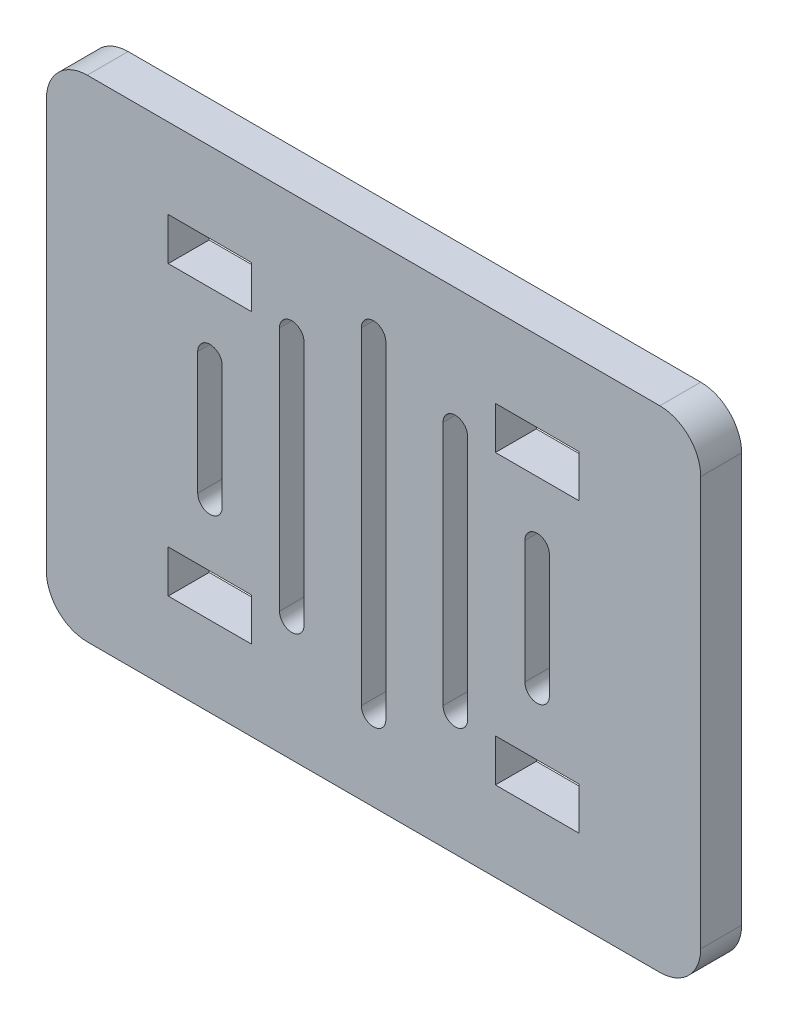
from build123d import *

# Parameters (mm, degrees)
SKETCH1_W           = 5.2
SKETCH1_H           = 10.2
BOSS_EXTRUDE1_DEPTH = 2.5
FILLET1_R           = 5


with BuildPart() as part:
    # Sketch1 → Boss-Extrude1 (new, symmetric)
    with BuildSketch(Plane(origin=(0, 0, 0), x_dir=(0, 1, 0), z_dir=(0, 0, 1))):
        Polygon((30, 0), (30, -20), (-30, -20), (-30, 0), (-30, 40), (-30, 60), (30, 60), (30, 40), align=None)
        with Locations((17.6, 0)):
            Rectangle(SKETCH1_W, SKETCH1_H, mode=Mode.SUBTRACT)
        with Locations((17.6, 40)):
            Rectangle(SKETCH1_W, SKETCH1_H, mode=Mode.SUBTRACT)
        with Locations((-17.6, 0)):
            Rectangle(SKETCH1_W, SKETCH1_H, mode=Mode.SUBTRACT)
        with Locations((-17.6, 40)):
            Rectangle(SKETCH1_W, SKETCH1_H, mode=Mode.SUBTRACT)
        with BuildLine():
            Line((7.5, 41.5), (-7.5, 41.5))
            ThreePointArc((-7.5, 41.5), (-9, 40), (-7.5, 38.5))
            Line((-7.5, 38.5), (7.5, 38.5))
            ThreePointArc((7.5, 38.5), (9, 40), (7.5, 41.5))
        make_face(mode=Mode.SUBTRACT)
        with BuildLine():
            Line((15, 31.5), (-15, 31.5))
            ThreePointArc((-15, 31.5), (-16.5, 30), (-15, 28.5))
            Line((-15, 28.5), (15, 28.5))
            ThreePointArc((15, 28.5), (16.5, 30), (15, 31.5))
        make_face(mode=Mode.SUBTRACT)
        with BuildLine():
            Line((20, 21.5), (-20, 21.5))
            ThreePointArc((-20, 21.5), (-21.5, 20), (-20, 18.5))
            Line((-20, 18.5), (20, 18.5))
            ThreePointArc((20, 18.5), (21.5, 20), (20, 21.5))
        make_face(mode=Mode.SUBTRACT)
        with BuildLine():
            Line((15, 11.5), (-15, 11.5))
            ThreePointArc((-15, 11.5), (-16.5, 10), (-15, 8.5))
            Line((-15, 8.5), (15, 8.5))
            ThreePointArc((15, 8.5), (16.5, 10), (15, 11.5))
        make_face(mode=Mode.SUBTRACT)
        with BuildLine():
            Line((7.5, 1.5), (-7.5, 1.5))
            ThreePointArc((-7.5, 1.5), (-9, 0), (-7.5, -1.5))
            Line((-7.5, -1.5), (7.5, -1.5))
            ThreePointArc((7.5, -1.5), (9, 0), (7.5, 1.5))
        make_face(mode=Mode.SUBTRACT)
    extrude(amount=BOSS_EXTRUDE1_DEPTH, both=True)

    # Fillet1
    fillet1_edges = [part.edges().sort_by_distance(p)[0] for p in [
        (-60, -30, 0),
        (-60, 30, 0),
        (20, 30, 0),
        (20, -30, 0),
    ]]
    fillet(fillet1_edges, radius=FILLET1_R)


solid = part.part
